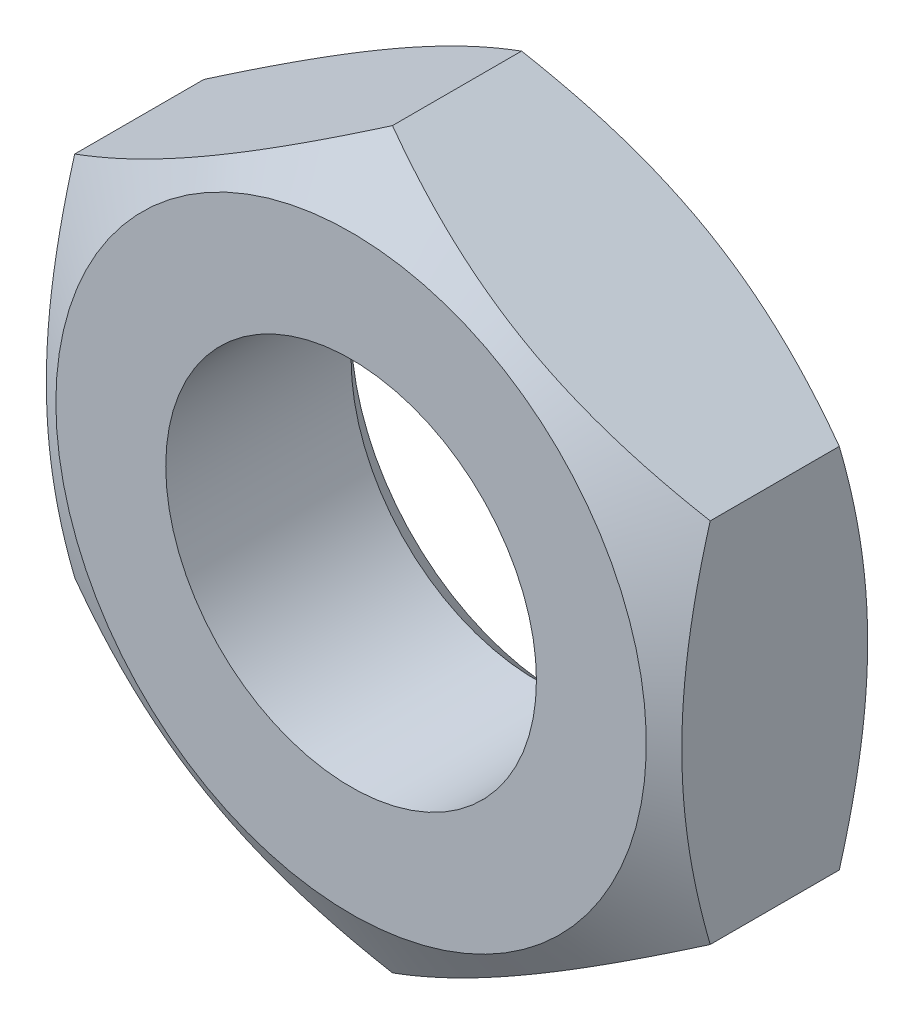
from build123d import *

# Parameters (mm, degrees)
SKETCH_1_R      = 7
EXTRUDE_1_DEPTH = 8
CHAMFER_1_SIZE  = 1


with BuildPart() as part:
    # Эскиз1 → Бобышка-Вытянуть1 (new body)
    with BuildSketch(Plane.XY):
        Polygon((0, 13.856406461), (-12, 6.92820323), (-12, -6.92820323), (0, -13.856406461), (12, -6.92820323), (12, 6.92820323), align=None)
        Circle(SKETCH_1_R, mode=Mode.SUBTRACT)
    extrude(amount=EXTRUDE_1_DEPTH)

    # Эскиз2 → Вырез-Повернуть1 (revolve, cut)
    with BuildSketch(Plane(origin=(0, 0, 0), x_dir=(0, 0, -1), z_dir=(1, 0, 0)), mode=Mode.PRIVATE) as cut_revolve_1_sk:
        Polygon((0, 13.856406461), (-1.562544499, 13.856406461), (0, 11.15), align=None)
        Polygon((-8, 11.15), (-8, 13.856406461), (-6.437455501, 13.856406461), align=None)
    revolve(cut_revolve_1_sk.sketch.rotate(Axis((0, 0, 0), (0, 0, 1)), 90), axis=Axis((0, 0, 0), (0, 0, 1)), mode=Mode.SUBTRACT)

    # Фаска1
    chamfer_1_edges = [part.edges().sort_by_distance(p)[0] for p in [
        (-7, 0, 0),
    ]]
    chamfer(chamfer_1_edges, length=CHAMFER_1_SIZE)


solid = part.part
